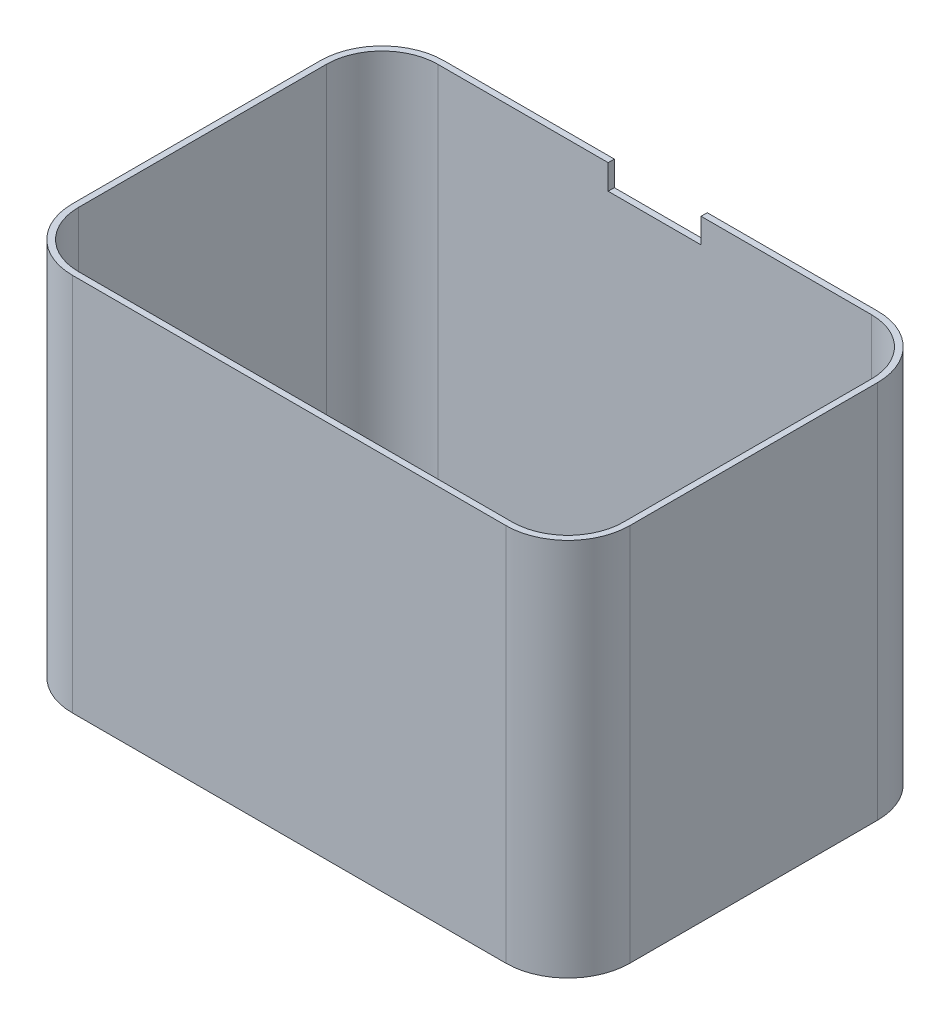
from build123d import *

# Parameters (mm, degrees)
EXTRUDE_1_DEPTH     = 1.2
EXTRUDE_2_DEPTH     = 60
SKETCH_5_W          = 15
SKETCH_5_H          = 8
CUT_EXTRUDE_1_DEPTH = 1.5


with BuildPart() as part:
    # 草图1 → 凸台-拉伸1 (new body)
    with BuildSketch(Plane(origin=(0, 0, 0), x_dir=(1, 0, 0), z_dir=(0, 1, 0))):
        with BuildLine():
            Line((-35, 30), (35, 30))
            ThreePointArc((35, 30), (42.071067812, 27.071067812), (45, 20))
            Line((45, 20), (45, -20))
            ThreePointArc((45, -20), (42.071067812, -27.071067812), (35, -30))
            Line((35, -30), (-35, -30))
            ThreePointArc((-35, -30), (-42.071067812, -27.071067812), (-45, -20))
            Line((-45, -20), (-45, 20))
            ThreePointArc((-45, 20), (-42.071067812, 27.071067812), (-35, 30))
        make_face()
    extrude(amount=EXTRUDE_1_DEPTH)

    # 草图2 → 凸台-拉伸2 (add)
    with BuildSketch(Plane(origin=(0, 1.2, 0), x_dir=(1, 0, 0), z_dir=(0, 1, 0))):
        with BuildLine():
            Line((45, -20), (45, 20))
            ThreePointArc((45, 20), (42.071067812, 27.071067812), (35, 30))
            Line((35, 30), (-35, 30))
            ThreePointArc((-35, 30), (-42.071067812, 27.071067812), (-45, 20))
            Line((-45, 20), (-45, -20))
            ThreePointArc((-45, -20), (-42.071067812, -27.071067812), (-35, -30))
            Line((-35, -30), (35, -30))
            ThreePointArc((35, -30), (42.071067812, -27.071067812), (45, -20))
        make_face()
        with BuildLine():
            Line((44, -20), (44, 20))
            ThreePointArc((44, 20), (41.363961031, 26.363961031), (35, 29))
            Line((35, 29), (-35, 29))
            ThreePointArc((-35, 29), (-41.363961031, 26.363961031), (-44, 20))
            Line((-44, 20), (-44, -20))
            ThreePointArc((-44, -20), (-41.363961031, -26.363961031), (-35, -29))
            Line((-35, -29), (35, -29))
            ThreePointArc((35, -29), (41.363961031, -26.363961031), (44, -20))
        make_face(mode=Mode.SUBTRACT)
    extrude(amount=EXTRUDE_2_DEPTH)

    # 草图5 → 切除-拉伸1 (cut)
    with BuildSketch(Plane(origin=(0, 0, -30), x_dir=(-1, 0, 0), z_dir=(0, 0, -1))):
        with Locations((0, 61.2)):
            Rectangle(SKETCH_5_W, SKETCH_5_H)
    extrude(amount=-CUT_EXTRUDE_1_DEPTH, mode=Mode.SUBTRACT)


solid = part.part
